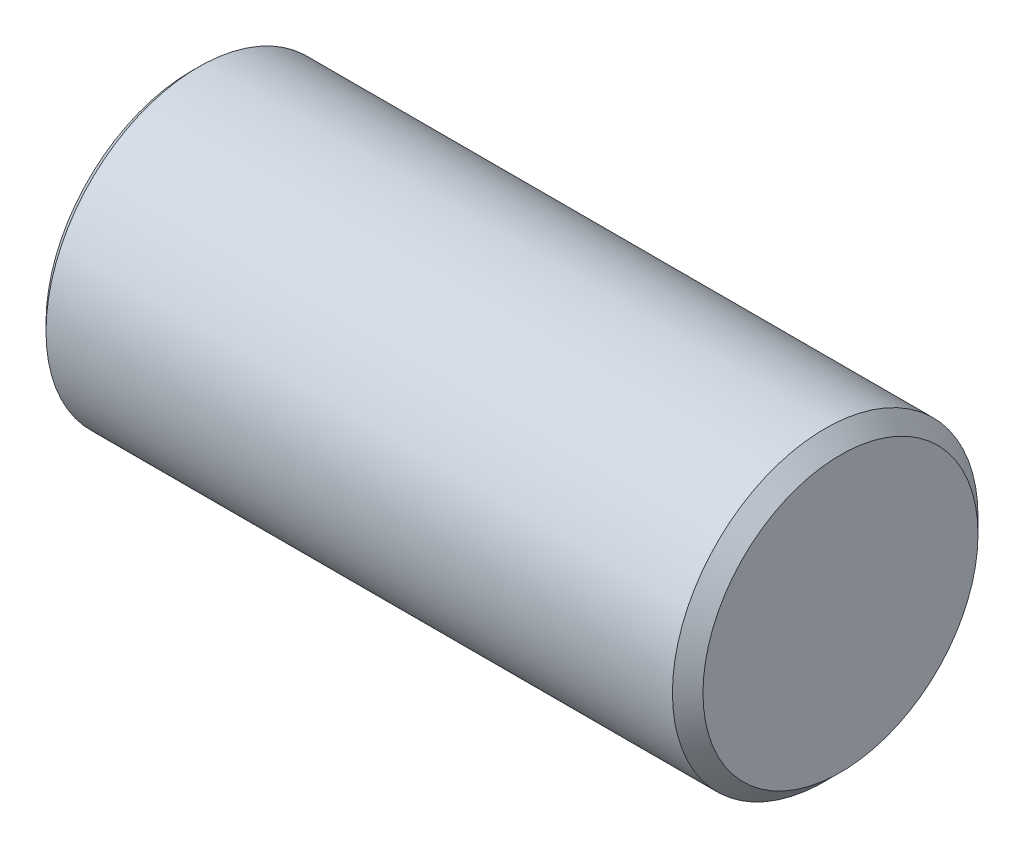
from build123d import *


with BuildPart() as part:
    # Эскиз1 → Повернуть4 (revolve)
    with BuildSketch(Plane(origin=(0, 0, 0), x_dir=(1, 0, 0), z_dir=(0, 1, 0))):
        Polygon((92.65287472, 0), (92.65287472, 18), (90.65287472, 20), (8.65287472, 20), (7.65287472, 19), (7.65287472, 14.750046626), (8.65287472, 13.750046626), (71.629429714, 13.750046626), (71.629429714, 3.430205497), (76.798526349, 0), align=None)
    revolve(axis=Axis((102.994030824, 0, 0), (-1, 0, 0)))


solid = part.part
